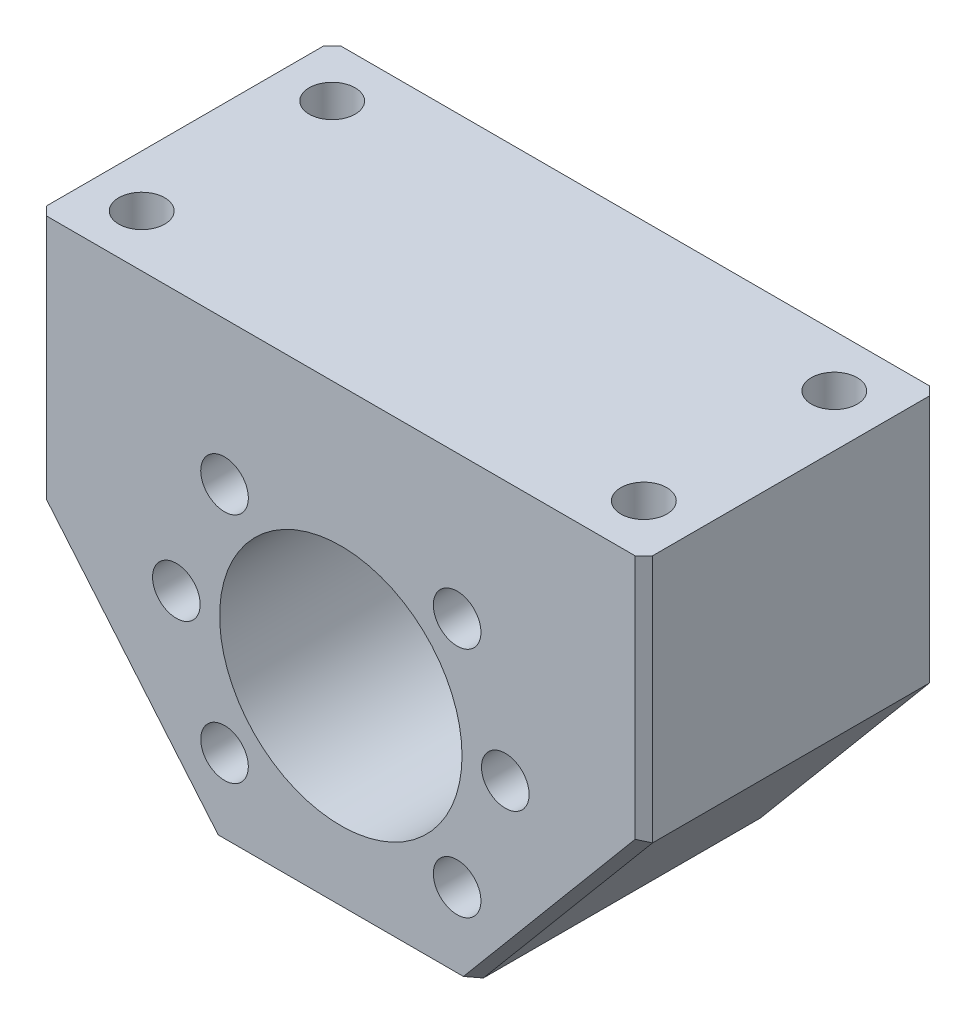
from build123d import *

# Parameters (mm, degrees)
SKETCH1_R           = 14
SKETCH1_R_2         = 2.75
BOSS_EXTRUDE1_DEPTH = 17
SKETCH2_R           = 2.65
CUT_EXTRUDE1_DEPTH  = 10
CHAMFER1_SIZE       = 1


with BuildPart() as part:
    # Sketch1 → Boss-Extrude1 (new, symmetric)
    with BuildSketch(Plane.XY):
        Polygon((15.46675804, -22), (-15.46675804, -22), (-35, 1.278811281), (-35, 30), (35, 30), (35, 1.278811281), align=None)
        Circle(SKETCH1_R, mode=Mode.SUBTRACT)
        with Locations((-13.435028843, -13.435028843)):
            Circle(SKETCH1_R_2, mode=Mode.SUBTRACT)
        with Locations((-19, 0)):
            Circle(SKETCH1_R_2, mode=Mode.SUBTRACT)
        with Locations(Location((-13.435028843, 13.435028843, 0), (0, 0, 180))):
            Circle(SKETCH1_R_2, mode=Mode.SUBTRACT)
        with Locations((13.435028843, 13.435028843)):
            Circle(SKETCH1_R_2, mode=Mode.SUBTRACT)
        with Locations(Location((19, 0, 0), (0, 0, 180))):
            Circle(SKETCH1_R_2, mode=Mode.SUBTRACT)
        with Locations(Location((13.435028843, -13.435028843, 0), (0, 0, 180))):
            Circle(SKETCH1_R_2, mode=Mode.SUBTRACT)
    extrude(amount=BOSS_EXTRUDE1_DEPTH, both=True)

    # Sketch2 → Cut-Extrude1 (cut)
    with BuildSketch(Plane(origin=(0, 30, 0), x_dir=(1, 0, 0), z_dir=(0, 1, 0))):
        with Locations(Location((-29, 11, 0), (0, 0, 180))):
            Circle(SKETCH2_R)
        with Locations(Location((-29, -11, 0), (0, 0, 180))):
            Circle(SKETCH2_R)
        with Locations(Location((29, -11, 0), (0, 0, 180))):
            Circle(SKETCH2_R)
        with Locations(Location((29, 11, 0), (0, 0, 180))):
            Circle(SKETCH2_R)
    extrude(amount=-CUT_EXTRUDE1_DEPTH, mode=Mode.SUBTRACT)

    # Chamfer1
    chamfer1_edges = [part.edges().sort_by_distance(p)[0] for p in [
        (-35, 15.639405641, 17),
        (-25.23337902, -10.360594359, 17),
        (25.23337902, -10.360594359, 17),
        (35, 15.639405641, 17),
        (25.23337902, -10.360594359, -17),
        (-25.23337902, -10.360594359, -17),
        (-35, 15.639405641, -17),
        (35, 15.639405641, -17),
    ]]
    chamfer(chamfer1_edges, length=CHAMFER1_SIZE)


solid = part.part
